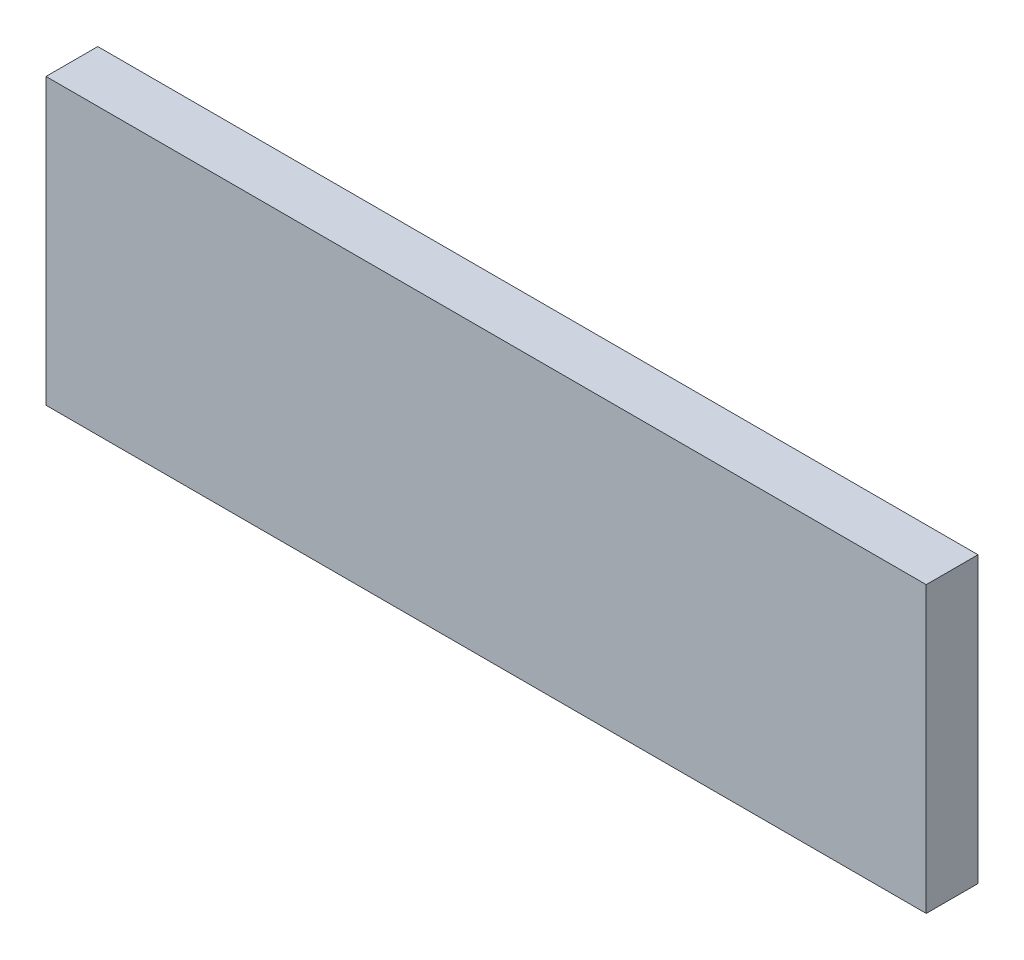
from build123d import *

# Parameters (mm, degrees)
SKETCH1_W                                  = 170
SKETCH1_H                                  = 55
REFERENCE_ENVELOPE_NOT_MANUFACTURING_DEPTH = 10


with BuildPart() as part:
    # Sketch1 → REFERENCE_ENVELOPE_NOT_MANUFACTURING (new body)
    with BuildSketch(Plane.XY):
        Rectangle(SKETCH1_W, SKETCH1_H)
    extrude(amount=REFERENCE_ENVELOPE_NOT_MANUFACTURING_DEPTH)


solid = part.part
